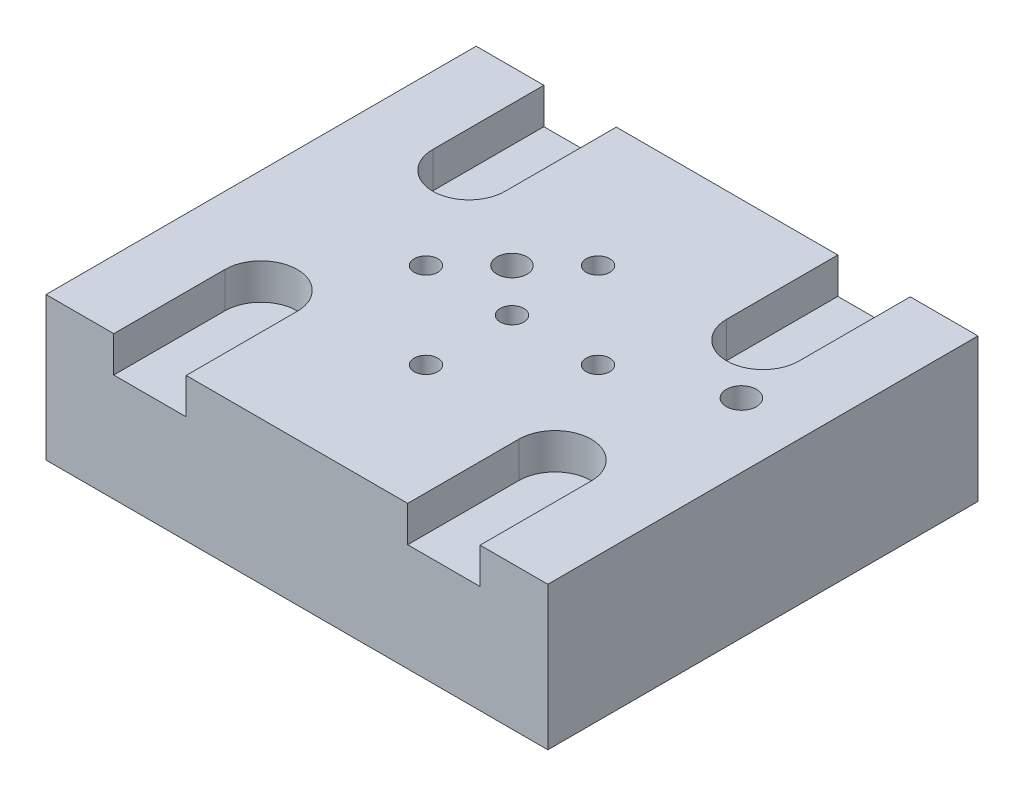
from build123d import *

# Parameters (mm, degrees)
SKETCH3_W           = 70
SKETCH3_H           = 60
BOSS_EXTRUDE3_DEPTH = 20
SKETCH4_R           = 1.65
CUT_EXTRUDE1_DEPTH  = 95.339811321
SKETCH6_R           = 2.1
CUT_EXTRUDE2_DEPTH  = 95.339811321
SKETCH9_R           = 3.25
CUT_EXTRUDE3_DEPTH  = 40.25
CUT_EXTRUDE4_START  = -3
SKETCH11_R          = 3
SKETCH11_R_2        = 1.65
CUT_EXTRUDE4_DEPTH  = 3
CHAMFER1_SIZE       = 0.8
CUT_EXTRUDE5_DEPTH  = 5


with BuildPart() as part:
    # Sketch3 → Boss-Extrude3 (new body)
    with BuildSketch(Plane(origin=(0, 0, 0), x_dir=(1, 0, 0), z_dir=(0, 1, 0))):
        with Locations((35, -30)):
            Rectangle(SKETCH3_W, SKETCH3_H)
    extrude(amount=BOSS_EXTRUDE3_DEPTH)

    # Sketch4 → Cut-Extrude1 (cut, through all)
    with BuildSketch(Plane(origin=(0, 20, 0), x_dir=(1, 0, 0), z_dir=(0, 1, 0))):
        with Locations(Location((35, -30, 0), (0, 0, 270))):
            Circle(SKETCH4_R)
        with Locations(Location((35, -18, 0), (0, 0, 270))):
            Circle(SKETCH4_R)
        with Locations(Location((47, -30, 0), (0, 0, 270))):
            Circle(SKETCH4_R)
        with Locations(Location((35, -42, 0), (0, 0, 270))):
            Circle(SKETCH4_R)
        with Locations(Location((23, -30, 0), (0, 0, 270))):
            Circle(SKETCH4_R)
    extrude(amount=-CUT_EXTRUDE1_DEPTH, mode=Mode.SUBTRACT)

    # Sketch6 → Cut-Extrude2 (cut, through all)
    with BuildSketch(Plane.XZ):
        with Locations(Location((61, 24, 0), (0, 0, 270))):
            Circle(SKETCH6_R)
        with Locations(Location((29, 24, 0), (0, 0, 270))):
            Circle(SKETCH6_R)
    extrude(amount=-CUT_EXTRUDE2_DEPTH, mode=Mode.SUBTRACT)

    # Sketch9 → Cut-Extrude3 (cut)
    with BuildSketch(Plane(origin=(0, 0, 0), x_dir=(-1, 0, 0), z_dir=(0, 0, -1))):
        with Locations((-53.2, 7.5)):
            Circle(SKETCH9_R)
        with Locations((-16.732176158, 7.5)):
            Circle(SKETCH9_R)
    extrude(amount=-CUT_EXTRUDE3_DEPTH, mode=Mode.SUBTRACT)

    # Sketch11 → Cut-Extrude4 (cut)
    # profile 1 of 10: a face of its own
    with BuildSketch(Plane.XZ.offset(CUT_EXTRUDE4_START)):
        with Locations(Location((35, 18, 0), (0, 0, 270))):
            Circle(SKETCH11_R)
        with Locations(Location((35, 18, 0), (0, 0, 90))):
            Circle(SKETCH11_R_2, mode=Mode.SUBTRACT)
    # profile 2 of 10: a face of its own
    with BuildSketch(Plane.XZ.offset(CUT_EXTRUDE4_START)):
        with Locations(Location((35, 30, 0), (0, 0, 270))):
            Circle(SKETCH11_R)
        with Locations(Location((35, 30, 0), (0, 0, 90))):
            Circle(SKETCH11_R_2, mode=Mode.SUBTRACT)
    # profile 3 of 10: a face of its own
    with BuildSketch(Plane.XZ.offset(CUT_EXTRUDE4_START)):
        with Locations(Location((47, 30, 0), (0, 0, 270))):
            Circle(SKETCH11_R)
        with Locations(Location((47, 30, 0), (0, 0, 90))):
            Circle(SKETCH11_R_2, mode=Mode.SUBTRACT)
    # profile 4 of 10: a face of its own
    with BuildSketch(Plane.XZ.offset(CUT_EXTRUDE4_START)):
        with Locations(Location((23, 30, 0), (0, 0, 270))):
            Circle(SKETCH11_R)
        with Locations(Location((23, 30, 0), (0, 0, 90))):
            Circle(SKETCH11_R_2, mode=Mode.SUBTRACT)
    # profile 5 of 10: a face of its own
    with BuildSketch(Plane.XZ.offset(CUT_EXTRUDE4_START)):
        with Locations(Location((35, 42, 0), (0, 0, 270))):
            Circle(SKETCH11_R)
        with Locations(Location((35, 42, 0), (0, 0, 90))):
            Circle(SKETCH11_R_2, mode=Mode.SUBTRACT)
    # profile 6 of 10: a face of its own
    with BuildSketch(Plane.XZ.offset(CUT_EXTRUDE4_START)):
        with Locations(Location((35, 42, 0), (0, 0, 90))):
            Circle(SKETCH11_R_2)
    # profile 7 of 10: a face of its own
    with BuildSketch(Plane.XZ.offset(CUT_EXTRUDE4_START)):
        with Locations(Location((23, 30, 0), (0, 0, 90))):
            Circle(SKETCH11_R_2)
    # profile 8 of 10: a face of its own
    with BuildSketch(Plane.XZ.offset(CUT_EXTRUDE4_START)):
        with Locations(Location((35, 30, 0), (0, 0, 90))):
            Circle(SKETCH11_R_2)
    # profile 9 of 10: a face of its own
    with BuildSketch(Plane.XZ.offset(CUT_EXTRUDE4_START)):
        with Locations(Location((47, 30, 0), (0, 0, 90))):
            Circle(SKETCH11_R_2)
    # profile 10 of 10: a face of its own
    with BuildSketch(Plane.XZ.offset(CUT_EXTRUDE4_START)):
        with Locations(Location((35, 18, 0), (0, 0, 90))):
            Circle(SKETCH11_R_2)
    extrude(amount=CUT_EXTRUDE4_DEPTH, mode=Mode.SUBTRACT)

    # Chamfer1
    chamfer1_edges = [part.edges().sort_by_distance(p)[0] for p in [
        (56.45, 7.5, 0),
        (19.982176158, 7.5, 0),
    ]]
    chamfer(chamfer1_edges, length=CHAMFER1_SIZE)

    # Sketch12 → Cut-Extrude5 (cut)
    with BuildSketch(Plane(origin=(0, 20, 0), x_dir=(1, 0, 0), z_dir=(0, 1, 0))):
        with BuildLine():
            Line((9.45, -60.104949747), (9.45, -44.5))
            ThreePointArc((9.45, -44.5), (14.5, -39.45), (19.55, -44.5))
            Line((19.55, -44.5), (19.55, -60.104949747))
            ThreePointArc((19.55, -60.104949747), (14.5, -65.154949747), (9.45, -60.104949747))
        make_face()
        with BuildLine():
            Line((60.55, -60.104949747), (60.55, -44.5))
            ThreePointArc((60.55, -44.5), (55.5, -39.45), (50.45, -44.5))
            Line((50.45, -44.5), (50.45, -60.104949747))
            ThreePointArc((50.45, -60.104949747), (55.5, -65.154949747), (60.55, -60.104949747))
        make_face()
        with BuildLine():
            Line((60.55, 0.104949747), (60.55, -15.5))
            ThreePointArc((60.55, -15.5), (55.5, -20.55), (50.45, -15.5))
            Line((50.45, -15.5), (50.45, 0.104949747))
            ThreePointArc((50.45, 0.104949747), (55.5, 5.154949747), (60.55, 0.104949747))
        make_face()
        with BuildLine():
            Line((9.45, 0.104949747), (9.45, -15.5))
            ThreePointArc((9.45, -15.5), (14.5, -20.55), (19.55, -15.5))
            Line((19.55, -15.5), (19.55, 0.104949747))
            ThreePointArc((19.55, 0.104949747), (14.5, 5.154949747), (9.45, 0.104949747))
        make_face()
    extrude(amount=-CUT_EXTRUDE5_DEPTH, mode=Mode.SUBTRACT)


solid = part.part
